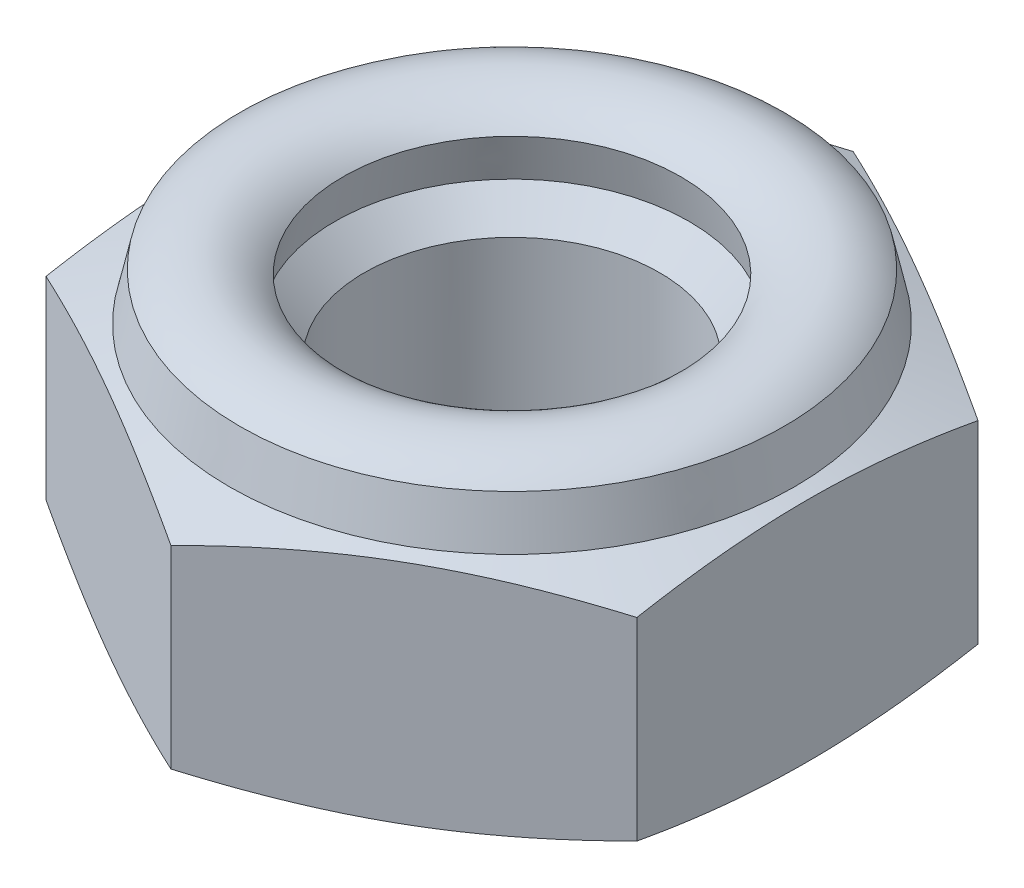
from build123d import *

# Parameters (mm, degrees)
EXTRUDE_1_DEPTH              = 1.6
HOLE_WIZARD_M2_1_D           = 1.6
HOLE_WIZARD_M2_1_DEPTH       = 6
HOLE_WIZARD_M2_1_CBORE_D     = 2
HOLE_WIZARD_M2_1_CBORE_DEPTH = 4
HOLE_WIZARD_M2_1_TIP         = 0.480688495
CHAMFER_1_SIZE               = 0.2


with BuildPart() as part:
    # 草图1 → 拉伸1 (new body)
    with BuildSketch(Plane(origin=(0, 0, 0), x_dir=(1, 0, 0), z_dir=(0, 1, 0))):
        Polygon((0, -2.309401077), (2, -1.154700538), (2, 1.154700538), (0, 2.309401077), (-2, 1.154700538), (-2, -1.154700538), align=None)
    extrude(amount=EXTRUDE_1_DEPTH)

    # M2 螺纹孔1
    with Locations(Plane(origin=(0, 1.6, 0), x_dir=(-1, 0, 0), z_dir=(0, 1, 0))):
        with Locations((0, 0)):
            CounterBoreHole(HOLE_WIZARD_M2_1_D / 2, HOLE_WIZARD_M2_1_CBORE_D / 2, HOLE_WIZARD_M2_1_CBORE_DEPTH, depth=HOLE_WIZARD_M2_1_DEPTH)
            with Locations((0, 0, -(HOLE_WIZARD_M2_1_DEPTH + HOLE_WIZARD_M2_1_TIP / 2))):  # 118° drill point
                Cone(0, HOLE_WIZARD_M2_1_D / 2, HOLE_WIZARD_M2_1_TIP, mode=Mode.SUBTRACT)

    # 草图4 → 切除-旋转2 (revolve, cut)
    with BuildSketch(Plane(origin=(0, 0, 0), x_dir=(0, 0, -1), z_dir=(1, 0, 0)), mode=Mode.PRIVATE) as cut_revolve_2_sk:
        Polygon((1.9124112, 0), (2.309401077, 0.144492499), (2.309401077, 0), align=None)
        Polygon((2.309401077, 1.6), (2.309401077, 1.455507501), (1.9124112, 1.6), align=None)
    revolve(cut_revolve_2_sk.sketch.rotate(Axis((0, 3.026713328, 0), (0, -1, 0)), 180), axis=Axis((0, 3.026713328, 0), (0, -1, 0)), mode=Mode.SUBTRACT)

    # 倒角1
    chamfer_1_edges = [part.edges().sort_by_distance(p)[0] for p in [
        (1, 0, 0),
        (1, 1.6, 0),
    ]]
    chamfer(chamfer_1_edges, length=CHAMFER_1_SIZE)

    # 草图5 → 旋转1 (revolve)
    with BuildSketch(Plane.XY, mode=Mode.PRIVATE) as revolve_1_sk:
        with BuildLine():
            Line((1.9124112, 1.6), (1.2, 1.6))
            Line((1.2, 1.6), (1.143418513, 1.890796389))
            ThreePointArc((1.143418513, 1.890796389), (1.487091006, 2.040622043), (1.841671491, 1.918838677))
            Line((1.841671491, 1.918838677), (1.9124112, 1.6))
        make_face()
    revolve(revolve_1_sk.sketch.rotate(Axis((0, 0, 0), (0, 1, 0)), 90), axis=Axis((0, 0, 0), (0, 1, 0)))


solid = part.part
